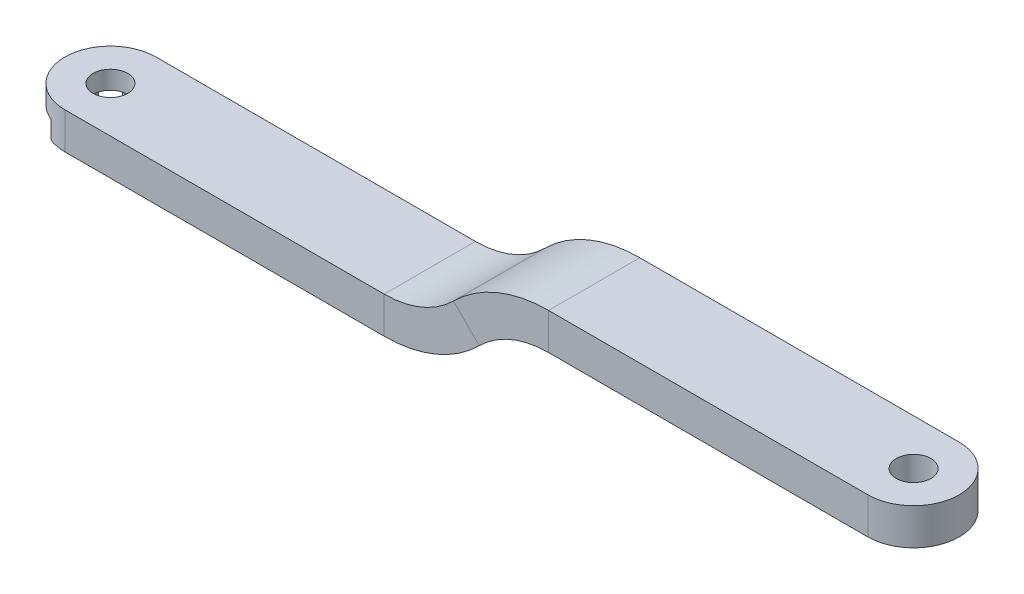
from build123d import *

# Parameters (mm, degrees)
SKETCH1_W               = 12.7
SKETCH1_H               = 5.08
CUT_EXTRUDE1_DEPTH      = 125.989350007
CUT_EXTRUDE1_DEPTH_BACK = 125.989350007
SKETCH5_R               = 2.413
FILLET1_RADIUS          = 6.35
FILLET1_LENGTH          = 5.08
FILLET2_RADIUS          = 6.35
FILLET2_LENGTH          = 5.08
CUT_EXTRUDE3_START      = -2.54
SKETCH6_R               = 2.413
CUT_EXTRUDE3_DEPTH      = 2.54


with BuildPart() as part:
    # Sweep1: sweep along a path in Sketch3
    with BuildLine(Plane.XY) as sweep1_path:
        Line((0, 0), (50.8, 0))
        ThreePointArc((50.8, 0), (56.988045526, 1.230878785), (62.234017215, 4.736125003))
        ThreePointArc((62.234017215, 4.736125003), (67.479988905, 8.241371221), (73.66803443, 9.472250006))
        Line((73.66803443, 9.472250006), (124.46803443, 9.472250006))
    # Sketch1 → Sweep1 (sweep)
    with BuildSketch(Plane(origin=(0, 0, 0), x_dir=(0, 0, -1), z_dir=(1, 0, 0))):
        Rectangle(SKETCH1_W, SKETCH1_H)
    sweep(path=sweep1_path.line)

    # Sketch5 → Cut-Extrude1 (cut, two sides: drawn at the far end of the back side and taken through both)
    with BuildSketch(Plane(origin=(0, 2.54, 0), x_dir=(1, 0, 0), z_dir=(0, 1, 0)).offset(-CUT_EXTRUDE1_DEPTH_BACK)):
        with Locations(Location((6.35, 0, 0), (0, 0, 270))):
            Circle(SKETCH5_R)
        with Locations(Location((118.11803443, 0, 0), (0, 0, 270))):
            Circle(SKETCH5_R)
    extrude(amount=CUT_EXTRUDE1_DEPTH + CUT_EXTRUDE1_DEPTH_BACK, mode=Mode.SUBTRACT)

    # Fillet1: full round fillet: the end face becomes a half cylinder, R = half its width
    fillet1_face = Plane((0, 0, 0), x_dir=(0, 1, 0), z_dir=(-1, 0, 0))  # on the end face: x along it, z out of the body
    fillet1_slab = fillet1_face.offset(-FILLET1_RADIUS / 2) * Box(FILLET1_LENGTH, 2 * FILLET1_RADIUS, FILLET1_RADIUS, mode=Mode.PRIVATE)  # the body's end, R deep
    fillet1_round = Plane((6.35, 0, 0), x_dir=(-1, 0, 0), z_dir=(0, 1, 0)) * Cylinder(FILLET1_RADIUS, FILLET1_LENGTH, mode=Mode.PRIVATE)  # its axis R under the face
    add(fillet1_slab - fillet1_round, mode=Mode.SUBTRACT)

    # Fillet2: full round fillet: the end face becomes a half cylinder, R = half its width
    fillet2_face = Plane((124.46803443, 9.472250006, 0), x_dir=(0, 1, 0), z_dir=(1, 0, 0))  # on the end face: x along it, z out of the body
    fillet2_slab = fillet2_face.offset(-FILLET2_RADIUS / 2) * Box(FILLET2_LENGTH, 2 * FILLET2_RADIUS, FILLET2_RADIUS, mode=Mode.PRIVATE)  # the body's end, R deep
    fillet2_round = Plane((118.11803443, 9.472250006, 0), x_dir=(1, 0, 0), z_dir=(0, 1, 0)) * Cylinder(FILLET2_RADIUS, FILLET2_LENGTH, mode=Mode.PRIVATE)  # its axis R under the face
    add(fillet2_slab - fillet2_round, mode=Mode.SUBTRACT)

    # Sketch6 → Cut-Extrude3 (cut)
    with BuildSketch(Plane.XZ.offset(2.54).offset(CUT_EXTRUDE3_START)):
        with BuildLine():
            Line((7.516419102, -2.815984815), (8.780039796, -5.866635031))
            ThreePointArc((8.780039796, -5.866635031), (10.840128061, -4.490128061), (12.216635031, -2.430039796))
            Line((12.216635031, -2.430039796), (9.165984815, -1.166419102))
            ThreePointArc((9.165984815, -1.166419102), (9.398, 0), (9.165984815, 1.166419102))
            Line((9.165984815, 1.166419102), (12.216635031, 2.430039796))
            ThreePointArc((12.216635031, 2.430039796), (10.840128061, 4.490128061), (8.780039796, 5.866635031))
            Line((8.780039796, 5.866635031), (7.516419102, 2.815984815))
            ThreePointArc((7.516419102, 2.815984815), (6.35, 3.048), (5.183580898, 2.815984815))
            Line((5.183580898, 2.815984815), (3.919960204, 5.866635031))
            ThreePointArc((3.919960204, 5.866635031), (1.859871939, 4.490128061), (0.483364969, 2.430039796))
            Line((0.483364969, 2.430039796), (3.534015185, 1.166419102))
            ThreePointArc((3.534015185, 1.166419102), (3.302, 0), (3.534015185, -1.166419102))
            Line((3.534015185, -1.166419102), (0.483364969, -2.430039796))
            ThreePointArc((0.483364969, -2.430039796), (1.859871939, -4.490128061), (3.919960204, -5.866635031))
            Line((3.919960204, -5.866635031), (5.183580898, -2.815984815))
            ThreePointArc((5.183580898, -2.815984815), (6.35, -3.048), (7.516419102, -2.815984815))
        make_face()
        with Locations(Location((6.35, 0, 0), (0, 0, 90))):
            Circle(SKETCH6_R, mode=Mode.SUBTRACT)
    extrude(amount=CUT_EXTRUDE3_DEPTH, mode=Mode.SUBTRACT)


solid = part.part
